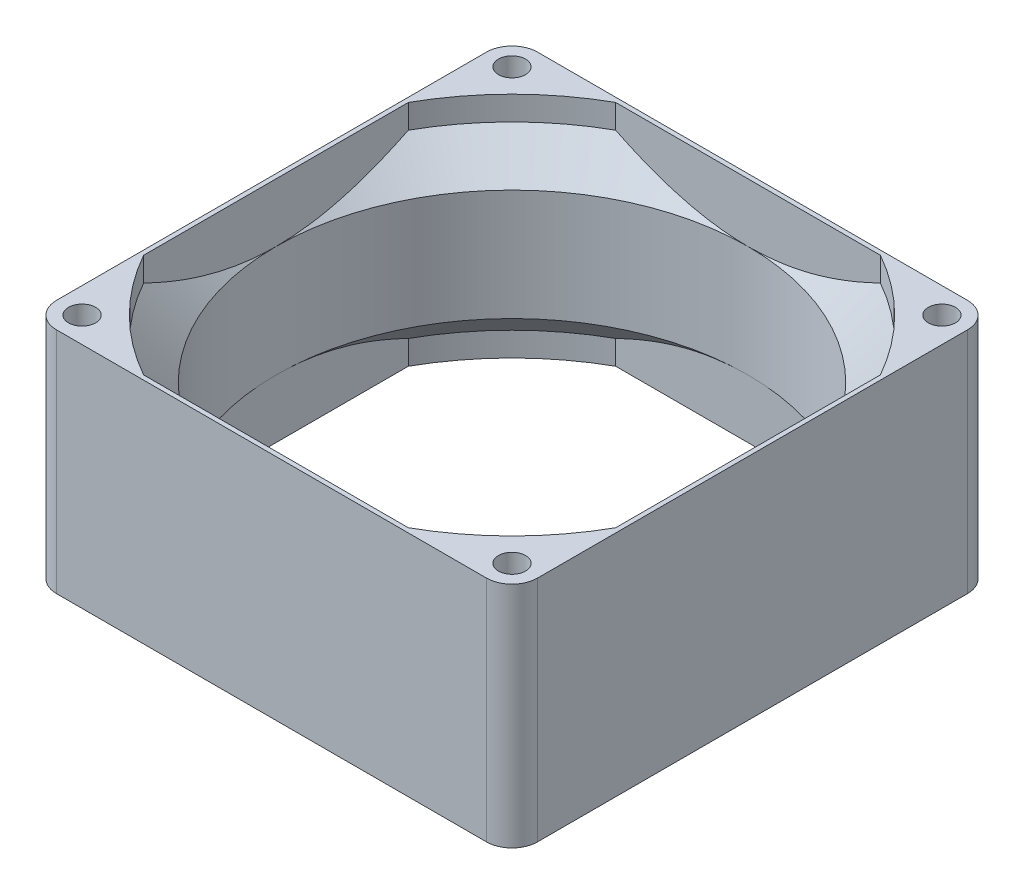
from build123d import *

# Parameters (mm, degrees)
SKETCH1_R               = 2.25
BOSS_EXTRUDE1_DEPTH     = 38
CUT_EXTRUDE1_DEPTH      = 75.121521841
CUT_EXTRUDE1_DEPTH_BACK = 75.121521841


with BuildPart() as part:
    # Sketch1 → Boss-Extrude1 (new body)
    with BuildSketch(Plane(origin=(0, 0, 0), x_dir=(1, 0, 0), z_dir=(0, 1, 0))):
        with BuildLine():
            Line((-35.75, -40), (35.75, -40))
            ThreePointArc((35.75, -40), (38.75520382, -38.75520382), (40, -35.75))
            Line((40, -35.75), (40, 35.75))
            ThreePointArc((40, 35.75), (38.75520382, 38.75520382), (35.75, 40))
            Line((35.75, 40), (-35.75, 40))
            ThreePointArc((-35.75, 40), (-38.75520382, 38.75520382), (-40, 35.75))
            Line((-40, 35.75), (-40, -35.75))
            ThreePointArc((-40, -35.75), (-38.75520382, -38.75520382), (-35.75, -40))
        make_face()
        with Locations(Location((35.75, 35.75, 0), (0, 0, 270))):
            Circle(SKETCH1_R, mode=Mode.SUBTRACT)
        with Locations(Location((35.75, -35.75, 0), (0, 0, 270))):
            Circle(SKETCH1_R, mode=Mode.SUBTRACT)
        with Locations(Location((-35.75, -35.75, 0), (0, 0, 270))):
            Circle(SKETCH1_R, mode=Mode.SUBTRACT)
        with Locations(Location((-35.75, 35.75, 0), (0, 0, 270))):
            Circle(SKETCH1_R, mode=Mode.SUBTRACT)
        with BuildLine():
            Line((22.009940936, 39.25), (-22.009940936, 39.25))
            ThreePointArc((-22.009940936, 39.25), (-31.819805153, 31.819805153), (-39.25, 22.009940936))
            Line((-39.25, 22.009940936), (-39.25, -22.009940936))
            ThreePointArc((-39.25, -22.009940936), (-31.819805153, -31.819805153), (-22.009940936, -39.25))
            Line((-22.009940936, -39.25), (22.009940936, -39.25))
            ThreePointArc((22.009940936, -39.25), (31.819805153, -31.819805153), (39.25, -22.009940936))
            Line((39.25, -22.009940936), (39.25, 22.009940936))
            ThreePointArc((39.25, 22.009940936), (31.819805153, 31.819805153), (22.009940936, 39.25))
        make_face(mode=Mode.SUBTRACT)
    extrude(amount=BOSS_EXTRUDE1_DEPTH)

    # Sketch2 → Revolve1 (revolve)
    with BuildSketch(Plane(origin=(0, 0, 0), x_dir=(0, 0, -1), z_dir=(1, 0, 0))):
        Polygon((45, 4), (39.25, 9.75), (39.25, 28.25), (45, 34), align=None)
    revolve(axis=Axis((0, 0, 0), (0, 1, 0)))

    # Sketch3 → Cut-Extrude1 (cut, two sides: drawn at the far end of the back side and taken through both)
    with BuildSketch(Plane(origin=(0, 0, 0), x_dir=(1, 0, 0), z_dir=(0, 1, 0)).offset(-CUT_EXTRUDE1_DEPTH_BACK)):
        with BuildLine():
            Line((-40, -35.75), (-40, 35.75))
            ThreePointArc((-40, 35.75), (-39.676488013, 37.376404588), (-38.75520382, 38.75520382))
            ThreePointArc((-38.75520382, 38.75520382), (-54.808134855, 0), (-38.75520382, -38.75520382))
            ThreePointArc((-38.75520382, -38.75520382), (-39.676488013, -37.376404588), (-40, -35.75))
        make_face()
        with BuildLine():
            ThreePointArc((-35.75, -40), (-37.376404588, -39.676488013), (-38.75520382, -38.75520382))
            ThreePointArc((-38.75520382, -38.75520382), (6e-09, -54.808134855), (38.755203828, -38.755203812))
            ThreePointArc((38.755203828, -38.755203812), (37.376404593, -39.676488011), (35.75, -40))
            Line((35.75, -40), (-35.75, -40))
        make_face()
        with BuildLine():
            ThreePointArc((54.808134855, 0), (50.636113998, 20.97416519), (38.755203786, 38.755203854))
            ThreePointArc((38.755203786, 38.755203854), (39.676488004, 37.376404609), (40, 35.75))
            Line((40, 35.75), (40, -35.75))
            ThreePointArc((40, -35.75), (39.676488015, -37.376404582), (38.755203828, -38.755203812))
            ThreePointArc((38.755203828, -38.755203812), (50.63611401, -20.974165163), (54.808134855, 0))
        make_face()
        with BuildLine():
            ThreePointArc((38.755203786, 38.755203854), (-2.4e-08, 54.808134855), (-38.75520382, 38.75520382))
            ThreePointArc((-38.75520382, 38.75520382), (-37.376404588, 39.676488013), (-35.75, 40))
            Line((-35.75, 40), (35.75, 40))
            ThreePointArc((35.75, 40), (37.376404566, 39.676488022), (38.755203786, 38.755203854))
        make_face()
    extrude(amount=CUT_EXTRUDE1_DEPTH + CUT_EXTRUDE1_DEPTH_BACK, mode=Mode.SUBTRACT)


solid = part.part
